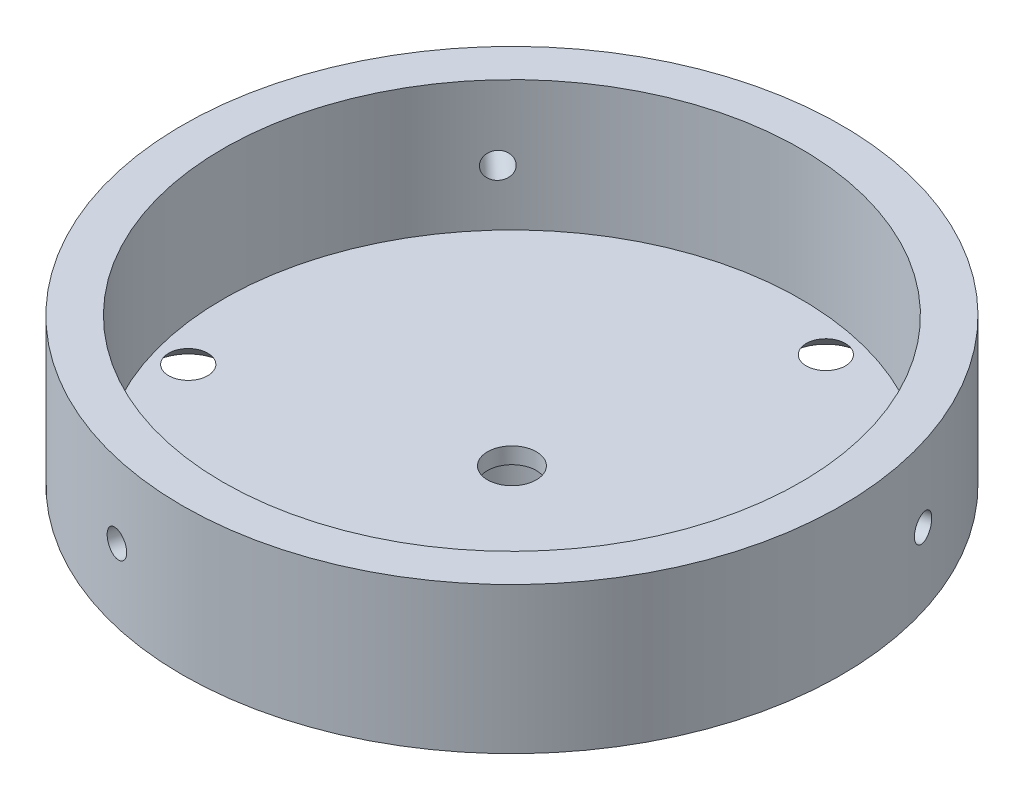
from build123d import *

# Parameters (mm, degrees)
SKETCH1_R           = 20.25
BOSS_EXTRUDE1_DEPTH = 9
SKETCH2_R           = 17.75
CUT_EXTRUDE1_DEPTH  = 8
CIRPATTERN1_COUNT   = 3
SKETCH5_R           = 1.5
CUT_EXTRUDE2_DEPTH  = 8
CIRPATTERN2_COUNT   = 3
SKETCH7_R           = 4
BOSS_EXTRUDE3_DEPTH = 4
SKETCH8_R           = 3.265
CUT_EXTRUDE3_DEPTH  = 4


with BuildPart() as part:
    # Sketch1 → Boss-Extrude1 (new body)
    with BuildSketch(Plane(origin=(0, 0, 0), x_dir=(1, 0, 0), z_dir=(0, 1, 0))):
        with Locations(Location((0, 0, 0), (0, 0, 270))):
            Circle(SKETCH1_R)
    extrude(amount=BOSS_EXTRUDE1_DEPTH)

    # Sketch2 → Cut-Extrude1 (cut)
    with BuildSketch(Plane(origin=(0, 9, 0), x_dir=(1, 0, 0), z_dir=(0, 1, 0))):
        with Locations(Location((0, 0, 0), (0, 0, 270))):
            Circle(SKETCH2_R)
    extrude(amount=-CUT_EXTRUDE1_DEPTH, mode=Mode.SUBTRACT)

    # Sketch4 → CSK SLOT for M2 Countersunk Flat Head Screw1 (revolve, cut)
    with BuildSketch(Plane(origin=(11.609715894, 0, 11.00974554), x_dir=(0, 0, -1), z_dir=(1, 0, 0))):
        Polygon((0, 0), (0, 6.521032743), (1.2, 5.8), (1.2, 1), (2.2, 0), align=None)
    csk_slot_for_m2_countersunk_flat_head_sc = revolve(axis=Axis((11.609715894, -6.35, 11.00974554), (0, 1, 0)), mode=Mode.SUBTRACT)

    # CirPattern1: CSK SLOT for M2 Countersunk Flat Head Screw1 ×3 about axis
    cirpattern1_axis = Axis((0, 0, 0), (0, 1, 0))
    for i in range(1, CIRPATTERN1_COUNT):
        add(csk_slot_for_m2_countersunk_flat_head_sc.rotate(cirpattern1_axis, i * 360 / CIRPATTERN1_COUNT), mode=Mode.SUBTRACT)

    # Sketch5 → Cut-Extrude2 (cut)
    with BuildSketch(Plane.XZ):
        with Locations(Location((0, 0, 0), (0, 0, 270))):
            Circle(SKETCH5_R)
    extrude(amount=-CUT_EXTRUDE2_DEPTH, mode=Mode.SUBTRACT)

    # Sketch6 → M2 Tapped Hole1 (revolve, cut)
    with BuildSketch(Plane(origin=(-4.560794248, 4.445790719, 19.729715047), x_dir=(0.974306915892993, 0, 0.22522440729877435), z_dir=(0, 1, 0))):
        Polygon((0, 0), (0, 4.980688495), (0.8, 4.5), (0.8, 0), align=None)
    m2_tapped_hole1 = revolve(axis=Axis((-5.990969234, 4.445790719, 25.916563963), (0.22522440729877433, 0, -0.9743069158929931)), mode=Mode.SUBTRACT)

    # CirPattern2: M2 Tapped Hole1 ×3 about axis
    cirpattern2_axis = Axis((0, 9, 0), (0, -1, 0))
    for i in range(1, CIRPATTERN2_COUNT):
        add(m2_tapped_hole1.rotate(cirpattern2_axis, i * 360 / CIRPATTERN2_COUNT), mode=Mode.SUBTRACT)

    # Sketch7 → Boss-Extrude3 (add)
    with BuildSketch(Plane.XZ):
        with Locations(Location((0, 0, 0), (0, 0, 90))):
            Circle(SKETCH7_R)
    extrude(amount=BOSS_EXTRUDE3_DEPTH)

    # Sketch8 → Cut-Extrude3 (cut)
    with BuildSketch(Plane.XZ.offset(4)):
        with Locations(Location((0, 0, 0), (0, 0, 270))):
            Circle(SKETCH8_R)
    extrude(amount=-CUT_EXTRUDE3_DEPTH, mode=Mode.SUBTRACT)


solid = part.part
